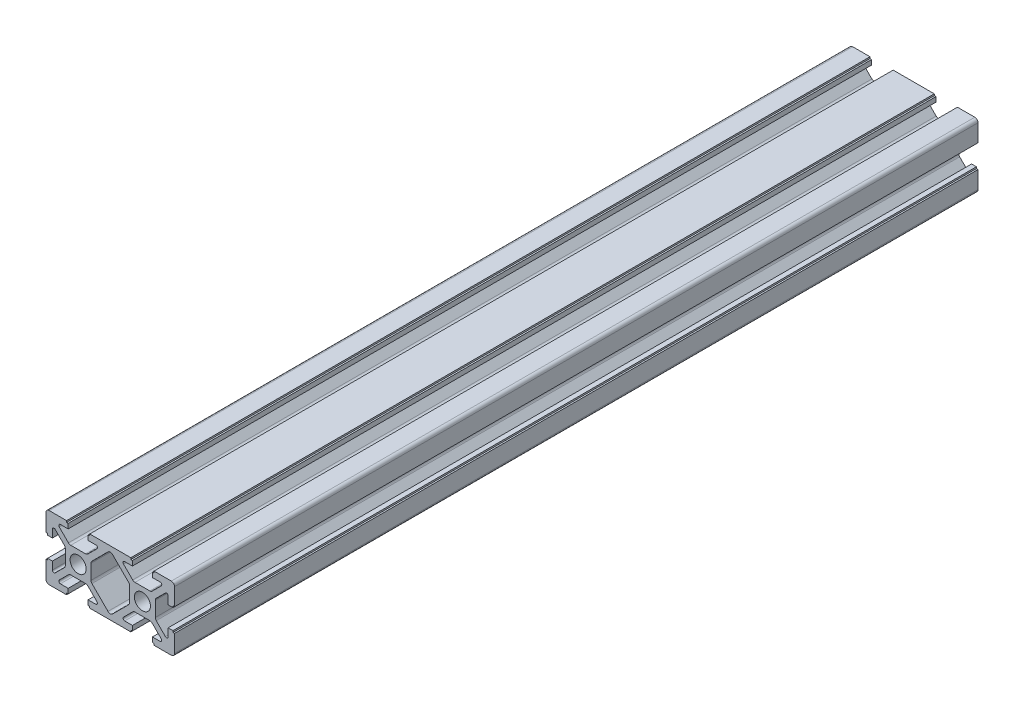
from build123d import *

# Parameters (mm, degrees)
SKETCH_1_R      = 2.5
EXTRUDE_1_DEPTH = 250


with BuildPart() as part:
    # 草图1 → 拉伸1 (new body)
    with BuildSketch(Plane.XY):
        with BuildLine():
            Line((36.486773435, 27.666621685), (39.340326826, 24.813068294))
            ThreePointArc((39.340326826, 24.813068294), (39.885221932, 24.704681919), (40.193880216, 25.166621685))
            Line((40.193880216, 25.166621685), (40.193880216, 27.586722697))
            Line((40.193880216, 27.586722697), (41.693880216, 27.586722697))
            Line((41.693880216, 27.586722697), (41.693880216, 27.086722697))
            Line((41.693880216, 27.086722697), (42.193880216, 27.086722697))
            Line((42.193880216, 27.086722697), (42.193880216, 21.686722697))
            ThreePointArc((42.193880216, 21.686722697), (41.900986997, 20.979615916), (41.193880216, 20.686722697))
            Line((41.193880216, 20.686722697), (35.793880216, 20.686722697))
            Line((35.793880216, 20.686722697), (35.793880216, 21.186722697))
            Line((35.793880216, 21.186722697), (35.293880216, 21.186722697))
            Line((35.293880216, 21.186722697), (35.293880216, 22.686722697))
            Line((35.293880216, 22.686722697), (37.713981229, 22.686722697))
            ThreePointArc((37.713981229, 22.686722697), (38.175920995, 22.995380981), (38.06753462, 23.540276088))
            Line((38.06753462, 23.540276088), (35.213981229, 26.393829479))
            ThreePointArc((35.213981229, 26.393829479), (34.88955788, 26.61060223), (34.506874448, 26.686722697))
            Line((34.506874448, 26.686722697), (29.880885985, 26.686722697))
            ThreePointArc((29.880885985, 26.686722697), (29.498202552, 26.61060223), (29.173779204, 26.393829479))
            Line((29.173779204, 26.393829479), (26.320225813, 23.540276088))
            ThreePointArc((26.320225813, 23.540276088), (26.211839437, 22.995380981), (26.673779204, 22.686722697))
            Line((26.673779204, 22.686722697), (29.093880216, 22.686722697))
            Line((29.093880216, 22.686722697), (29.093880216, 21.186722697))
            Line((29.093880216, 21.186722697), (28.593880216, 21.186722697))
            Line((28.593880216, 21.186722697), (28.593880216, 20.686722697))
            Line((28.593880216, 20.686722697), (15.793880216, 20.686722697))
            Line((15.793880216, 20.686722697), (15.793880216, 21.186722697))
            Line((15.793880216, 21.186722697), (15.293880216, 21.186722697))
            Line((15.293880216, 21.186722697), (15.293880216, 22.686722697))
            Line((15.293880216, 22.686722697), (17.713981229, 22.686722697))
            ThreePointArc((17.713981229, 22.686722697), (18.175920995, 22.995380981), (18.06753462, 23.540276088))
            Line((18.06753462, 23.540276088), (15.213981229, 26.393829479))
            ThreePointArc((15.213981229, 26.393829479), (14.88955788, 26.61060223), (14.506874448, 26.686722697))
            Line((14.506874448, 26.686722697), (9.880885985, 26.686722697))
            ThreePointArc((9.880885985, 26.686722697), (9.498202552, 26.61060223), (9.173779204, 26.393829479))
            Line((9.173779204, 26.393829479), (6.320225813, 23.540276088))
            ThreePointArc((6.320225813, 23.540276088), (6.211839437, 22.995380981), (6.673779204, 22.686722697))
            Line((6.673779204, 22.686722697), (9.093880216, 22.686722697))
            Line((9.093880216, 22.686722697), (9.093880216, 21.186722697))
            Line((9.093880216, 21.186722697), (8.593880216, 21.186722697))
            Line((8.593880216, 21.186722697), (8.593880216, 20.686722697))
            Line((8.593880216, 20.686722697), (3.193880216, 20.686722697))
            ThreePointArc((3.193880216, 20.686722697), (2.486773435, 20.979615916), (2.193880216, 21.686722697))
            Line((2.193880216, 21.686722697), (2.193880216, 27.086722697))
            Line((2.193880216, 27.086722697), (2.693880216, 27.086722697))
            Line((2.693880216, 27.086722697), (2.693880216, 27.586722697))
            Line((2.693880216, 27.586722697), (4.193880216, 27.586722697))
            Line((4.193880216, 27.586722697), (4.193880216, 25.166621685))
            ThreePointArc((4.193880216, 25.166621685), (4.5025385, 24.704681919), (5.047433607, 24.813068294))
            Line((5.047433607, 24.813068294), (7.900986997, 27.666621685))
            ThreePointArc((7.900986997, 27.666621685), (8.117759749, 27.991045034), (8.193880216, 28.373728466))
            Line((8.193880216, 28.373728466), (8.193880216, 32.999716929))
            ThreePointArc((8.193880216, 32.999716929), (8.117759749, 33.382400361), (7.900986997, 33.70682371))
            Line((7.900986997, 33.70682371), (5.047433607, 36.560377101))
            ThreePointArc((5.047433607, 36.560377101), (4.5025385, 36.668763476), (4.193880216, 36.20682371))
            Line((4.193880216, 36.20682371), (4.193880216, 33.786722697))
            Line((4.193880216, 33.786722697), (2.693880216, 33.786722697))
            Line((2.693880216, 33.786722697), (2.693880216, 34.286722697))
            Line((2.693880216, 34.286722697), (2.193880216, 34.286722697))
            Line((2.193880216, 34.286722697), (2.193880216, 39.686722697))
            ThreePointArc((2.193880216, 39.686722697), (2.486773435, 40.393829479), (3.193880216, 40.686722697))
            Line((3.193880216, 40.686722697), (8.593880216, 40.686722697))
            Line((8.593880216, 40.686722697), (8.593880216, 40.186722697))
            Line((8.593880216, 40.186722697), (9.093880216, 40.186722697))
            Line((9.093880216, 40.186722697), (9.093880216, 38.686722697))
            Line((9.093880216, 38.686722697), (6.673779204, 38.686722697))
            ThreePointArc((6.673779204, 38.686722697), (6.211839437, 38.378064414), (6.320225813, 37.833169307))
            Line((6.320225813, 37.833169307), (9.173779204, 34.979615916))
            ThreePointArc((9.173779204, 34.979615916), (9.498202552, 34.762843165), (9.880885985, 34.686722697))
            Line((9.880885985, 34.686722697), (14.506874448, 34.686722697))
            ThreePointArc((14.506874448, 34.686722697), (14.88955788, 34.762843165), (15.213981229, 34.979615916))
            Line((15.213981229, 34.979615916), (18.06753462, 37.833169307))
            ThreePointArc((18.06753462, 37.833169307), (18.175920995, 38.378064414), (17.713981229, 38.686722697))
            Line((17.713981229, 38.686722697), (15.293880216, 38.686722697))
            Line((15.293880216, 38.686722697), (15.293880216, 40.186722697))
            Line((15.293880216, 40.186722697), (15.793880216, 40.186722697))
            Line((15.793880216, 40.186722697), (15.793880216, 40.686722697))
            Line((15.793880216, 40.686722697), (28.593880216, 40.686722697))
            Line((28.593880216, 40.686722697), (28.593880216, 40.186722697))
            Line((28.593880216, 40.186722697), (29.093880216, 40.186722697))
            Line((29.093880216, 40.186722697), (29.093880216, 38.686722697))
            Line((29.093880216, 38.686722697), (26.673779204, 38.686722697))
            ThreePointArc((26.673779204, 38.686722697), (26.211839437, 38.378064414), (26.320225813, 37.833169307))
            Line((26.320225813, 37.833169307), (29.173779204, 34.979615916))
            ThreePointArc((29.173779204, 34.979615916), (29.498202552, 34.762843165), (29.880885985, 34.686722697))
            Line((29.880885985, 34.686722697), (34.506874448, 34.686722697))
            ThreePointArc((34.506874448, 34.686722697), (34.88955788, 34.762843165), (35.213981229, 34.979615916))
            Line((35.213981229, 34.979615916), (38.06753462, 37.833169307))
            ThreePointArc((38.06753462, 37.833169307), (38.175920995, 38.378064414), (37.713981229, 38.686722697))
            Line((37.713981229, 38.686722697), (35.293880216, 38.686722697))
            Line((35.293880216, 38.686722697), (35.293880216, 40.186722697))
            Line((35.293880216, 40.186722697), (35.793880216, 40.186722697))
            Line((35.793880216, 40.186722697), (35.793880216, 40.686722697))
            Line((35.793880216, 40.686722697), (41.193880216, 40.686722697))
            ThreePointArc((41.193880216, 40.686722697), (41.900986997, 40.393829479), (42.193880216, 39.686722697))
            Line((42.193880216, 39.686722697), (42.193880216, 34.286722697))
            Line((42.193880216, 34.286722697), (41.693880216, 34.286722697))
            Line((41.693880216, 34.286722697), (41.693880216, 33.786722697))
            Line((41.693880216, 33.786722697), (40.193880216, 33.786722697))
            Line((40.193880216, 33.786722697), (40.193880216, 36.20682371))
            ThreePointArc((40.193880216, 36.20682371), (39.885221932, 36.668763476), (39.340326826, 36.560377101))
            Line((39.340326826, 36.560377101), (36.486773435, 33.70682371))
            ThreePointArc((36.486773435, 33.70682371), (36.270000684, 33.382400361), (36.193880216, 32.999716929))
            Line((36.193880216, 32.999716929), (36.193880216, 28.373728466))
            ThreePointArc((36.193880216, 28.373728466), (36.270000684, 27.991045034), (36.486773435, 27.666621685))
        make_face()
        with Locations((12.193880216, 30.686722697)):
            Circle(SKETCH_1_R, mode=Mode.SUBTRACT)
        with Locations((32.193880216, 30.686722697)):
            Circle(SKETCH_1_R, mode=Mode.SUBTRACT)
        with BuildLine():
            Line((16.486773435, 27.666621685), (21.48677343, 22.66662169))
            ThreePointArc((21.48677343, 22.66662169), (22.193880211, 22.373728471), (22.900986992, 22.66662169))
            Line((22.900986992, 22.66662169), (27.900986992, 27.66662169))
            ThreePointArc((27.900986992, 27.66662169), (28.117759744, 27.991045039), (28.193880211, 28.373728471))
            Line((28.193880211, 28.373728471), (28.193880211, 32.999716923))
            ThreePointArc((28.193880211, 32.999716923), (28.117759744, 33.382400355), (27.900986992, 33.706823704))
            Line((27.900986992, 33.706823704), (22.900986992, 38.706823705))
            ThreePointArc((22.900986992, 38.706823705), (22.193880211, 38.999716923), (21.48677343, 38.706823705))
            Line((21.48677343, 38.706823705), (16.486773435, 33.70682371))
            ThreePointArc((16.486773435, 33.70682371), (16.270000684, 33.382400361), (16.193880216, 32.999716929))
            Line((16.193880216, 32.999716929), (16.193880216, 28.373728466))
            ThreePointArc((16.193880216, 28.373728466), (16.270000684, 27.991045034), (16.486773435, 27.666621685))
        make_face(mode=Mode.SUBTRACT)
    extrude(amount=EXTRUDE_1_DEPTH)


solid = part.part
